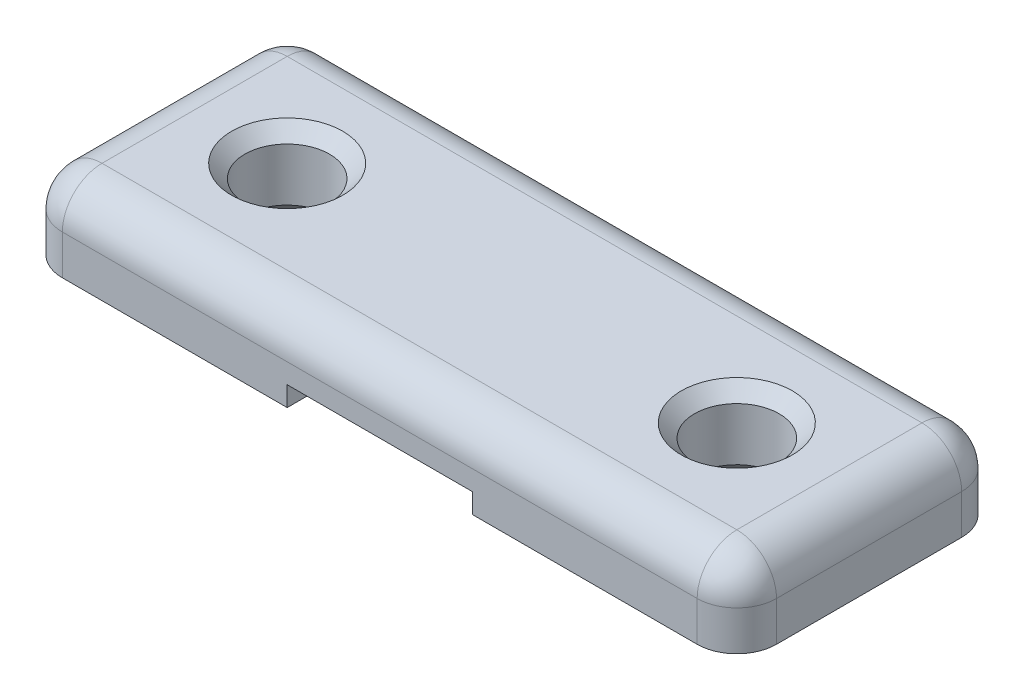
from build123d import *

# Parameters (mm, degrees)
SKETCH_1_W          = 27
SKETCH_1_H          = 10
SKETCH_1_R          = 1.6
EXTRUDE_1_DEPTH     = 3
CUT_EXTRUDE_1_DEPTH = 3.5
FILLET_1_R          = 1.5
CHAMFER_1_SIZE      = 0.5


with BuildPart() as part:
    # Эскиз1 → Бобышка-Вытянуть1 (new body)
    with BuildSketch(Plane(origin=(0, 0, 0), x_dir=(1, 0, 0), z_dir=(0, 1, 0))):
        Rectangle(SKETCH_1_W, SKETCH_1_H)
        with Locations(Location((-8.5, 0, 0), (0, 0, 270))):
            Circle(SKETCH_1_R, mode=Mode.SUBTRACT)
        with Locations(Location((8.5, 0, 0), (0, 0, 270))):
            Circle(SKETCH_1_R, mode=Mode.SUBTRACT)
    extrude(amount=EXTRUDE_1_DEPTH)

    # Эскиз2 → Вырез-Вытянуть1 (cut, symmetric)
    with BuildSketch(Plane(origin=(0, 0, 0), x_dir=(0, 0, -1), z_dir=(1, 0, 0))):
        with BuildLine():
            ThreePointArc((-3.494902022, 0.318181818), (-3.701518997, 0.086176097), (-4, 0))
            Line((-4, 0), (-2, 0))
            ThreePointArc((-2, 0), (-2.298481003, 0.086176097), (-2.505097978, 0.318181818))
            ThreePointArc((-2.505097978, 0.318181818), (-2.56176419, 0.46533442), (-2.594594195, 0.619565217))
            ThreePointArc((-2.594594195, 0.619565217), (-2.644405657, 0.712771412), (-2.743312728, 0.75))
            Line((-2.743312728, 0.75), (-3.256687272, 0.75))
            ThreePointArc((-3.256687272, 0.75), (-3.355594343, 0.712771412), (-3.405405805, 0.619565217))
            ThreePointArc((-3.405405805, 0.619565217), (-3.43823581, 0.46533442), (-3.494902022, 0.318181818))
        make_face()
        with BuildLine():
            ThreePointArc((-4.594594195, 0.619565217), (-4.644405657, 0.712771412), (-4.743312728, 0.75))
            Line((-4.743312728, 0.75), (-5, 0.75))
            Line((-5, 0.75), (-5, 0))
            Line((-5, 0), (-4, 0))
            ThreePointArc((-4, 0), (-4.298481003, 0.086176097), (-4.505097978, 0.318181818))
            ThreePointArc((-4.505097978, 0.318181818), (-4.56176419, 0.46533442), (-4.594594195, 0.619565217))
        make_face()
        with BuildLine():
            ThreePointArc((-1.494902022, 0.318181818), (-1.701518997, 0.086176097), (-2, 0))
            Line((-2, 0), (0, 0))
            ThreePointArc((0, 0), (-0.298481003, 0.086176097), (-0.505097978, 0.318181818))
            ThreePointArc((-0.505097978, 0.318181818), (-0.56176419, 0.46533442), (-0.594594195, 0.619565217))
            ThreePointArc((-0.594594195, 0.619565217), (-0.644405657, 0.712771412), (-0.743312728, 0.75))
            Line((-0.743312728, 0.75), (-1.256687272, 0.75))
            ThreePointArc((-1.256687272, 0.75), (-1.355594343, 0.712771412), (-1.405405805, 0.619565217))
            ThreePointArc((-1.405405805, 0.619565217), (-1.43823581, 0.46533442), (-1.494902022, 0.318181818))
        make_face()
        with BuildLine():
            ThreePointArc((0.505097978, 0.318181818), (0.298481003, 0.086176097), (0, 0))
            Line((0, 0), (2, 0))
            ThreePointArc((2, 0), (1.701518997, 0.086176097), (1.494902022, 0.318181818))
            ThreePointArc((1.494902022, 0.318181818), (1.43823581, 0.46533442), (1.405405805, 0.619565217))
            ThreePointArc((1.405405805, 0.619565217), (1.355594343, 0.712771412), (1.256687272, 0.75))
            Line((1.256687272, 0.75), (0.743312728, 0.75))
            ThreePointArc((0.743312728, 0.75), (0.644405657, 0.712771412), (0.594594195, 0.619565217))
            ThreePointArc((0.594594195, 0.619565217), (0.56176419, 0.46533442), (0.505097978, 0.318181818))
        make_face()
        with BuildLine():
            ThreePointArc((2.505097978, 0.318181818), (2.298481003, 0.086176097), (2, 0))
            Line((2, 0), (4, 0))
            ThreePointArc((4, 0), (3.701518997, 0.086176097), (3.494902022, 0.318181818))
            ThreePointArc((3.494902022, 0.318181818), (3.43823581, 0.46533442), (3.405405805, 0.619565217))
            ThreePointArc((3.405405805, 0.619565217), (3.355594343, 0.712771412), (3.256687272, 0.75))
            Line((3.256687272, 0.75), (2.743312728, 0.75))
            ThreePointArc((2.743312728, 0.75), (2.644405657, 0.712771412), (2.594594195, 0.619565217))
            ThreePointArc((2.594594195, 0.619565217), (2.56176419, 0.46533442), (2.505097978, 0.318181818))
        make_face()
        with BuildLine():
            ThreePointArc((4.505097978, 0.318181818), (4.298481003, 0.086176097), (4, 0))
            Line((4, 0), (5, 0))
            Line((5, 0), (5, 0.75))
            Line((5, 0.75), (4.743312728, 0.75))
            ThreePointArc((4.743312728, 0.75), (4.644405657, 0.712771412), (4.594594195, 0.619565217))
            ThreePointArc((4.594594195, 0.619565217), (4.56176419, 0.46533442), (4.505097978, 0.318181818))
        make_face()
    extrude(amount=CUT_EXTRUDE_1_DEPTH, both=True, mode=Mode.SUBTRACT)

    # Скругление1
    fillet_1_edges = [part.edges().sort_by_distance(p)[0] for p in [
        (-13.5, 3, 0),
        (0, 3, 5),
        (13.5, 3, 0),
        (0, 3, -5),
        (13.5, 1.5, 5),
        (-13.5, 1.5, 5),
        (-13.5, 1.5, -5),
        (13.5, 1.5, -5),
    ]]
    fillet(fillet_1_edges, radius=FILLET_1_R)

    # Фаска1
    chamfer_1_edges = [part.edges().sort_by_distance(p)[0] for p in [
        (-8.5, 0, -1.6),
        (-8.5, 3, -1.6),
        (8.5, 0, -1.6),
        (8.5, 3, -1.6),
    ]]
    chamfer(chamfer_1_edges, length=CHAMFER_1_SIZE)


solid = part.part
